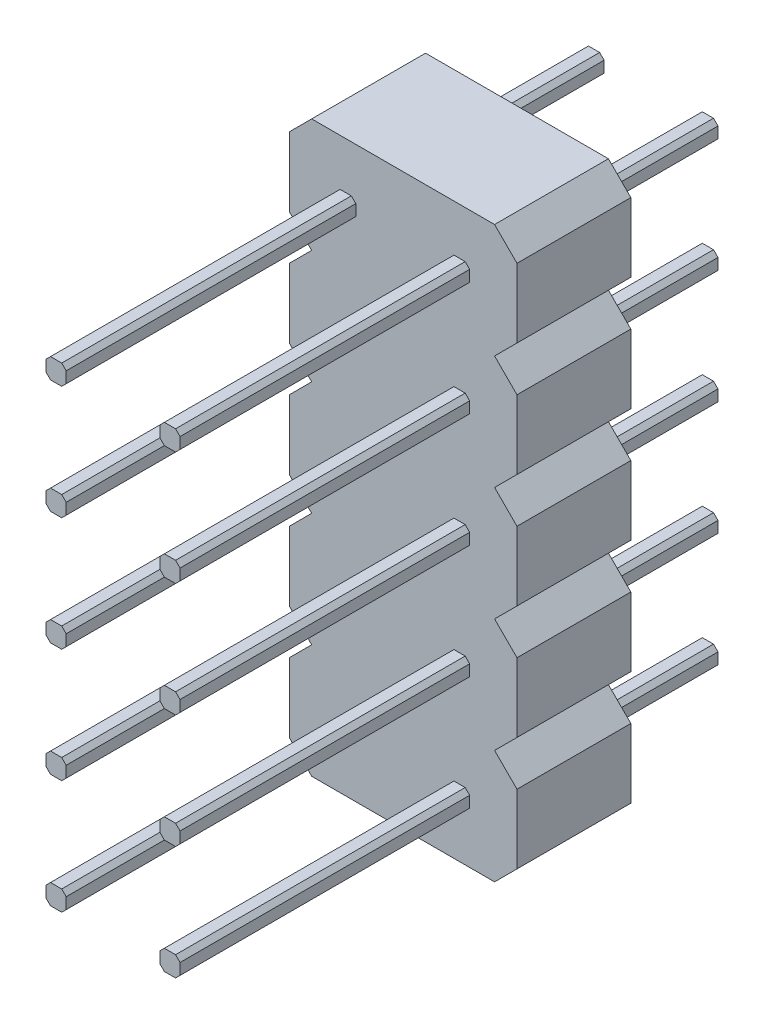
from build123d import *

# Parameters (mm, degrees)
BOSS_EXTRUDE1_DEPTH = 12
LPATTERN1_COUNT     = 2
LPATTERN1_PITCH     = 2.54
BOSS_EXTRUDE2_DEPTH = 2.54
LPATTERN2_COUNT     = 5
LPATTERN2_PITCH     = 2.54


with BuildPart() as part:
    # Sketch1 → Boss-Extrude1 (new body)
    with BuildSketch(Plane.XY):
        Polygon((-0.125, 0.225), (-0.225, 0.125), (-0.225, -0.125), (-0.125, -0.225), (0.125, -0.225), (0.225, -0.125), (0.225, 0.125), (0.125, 0.225), align=None)
    extrude(amount=BOSS_EXTRUDE1_DEPTH)


with BuildPart() as lpattern1_1:
    # LPattern1: pattern copy
    add(part.part.moved(Location(Vector(1, 0, 0) * (1 * LPATTERN1_PITCH))))


with BuildPart() as part_1:
    add(part.part)

    add(lpattern1_1.part)  # Boss-Extrude2 merges LPattern1_1
    # Sketch3 → Boss-Extrude2 (add)
    with BuildSketch(Plane(origin=(0, 0, 3), x_dir=(-1, 0, 0), z_dir=(0, 0, -1))):
        Polygon((-3.321218719, -1.27), (-3.821218719, -0.77), (-3.821218719, 0.77), (-3.321218719, 1.27), (0.758781281, 1.27), (1.258781281, 0.77), (1.258781281, -0.77), (0.758781281, -1.27), align=None)
    extrude(amount=-BOSS_EXTRUDE2_DEPTH)


with BuildPart() as lpattern2_1:
    # LPattern2: pattern copy
    add(part_1.part.moved(Location(Vector(0, 1, 0) * (1 * LPATTERN2_PITCH))))


with BuildPart() as lpattern2_2:
    # LPattern2: pattern copy
    add(part_1.part.moved(Location(Vector(0, 1, 0) * (2 * LPATTERN2_PITCH))))


with BuildPart() as lpattern2_3:
    # LPattern2: pattern copy
    add(part_1.part.moved(Location(Vector(0, 1, 0) * (3 * LPATTERN2_PITCH))))


with BuildPart() as lpattern2_4:
    # LPattern2: pattern copy
    add(part_1.part.moved(Location(Vector(0, 1, 0) * (4 * LPATTERN2_PITCH))))


with BuildPart() as part_2:
    add(part_1.part)

    # Combine1: union LPattern2_1, LPattern2_2, LPattern2_3, LPattern2_4
    add(lpattern2_1.part)
    add(lpattern2_2.part)
    add(lpattern2_3.part)
    add(lpattern2_4.part)


solid = part_2.part
